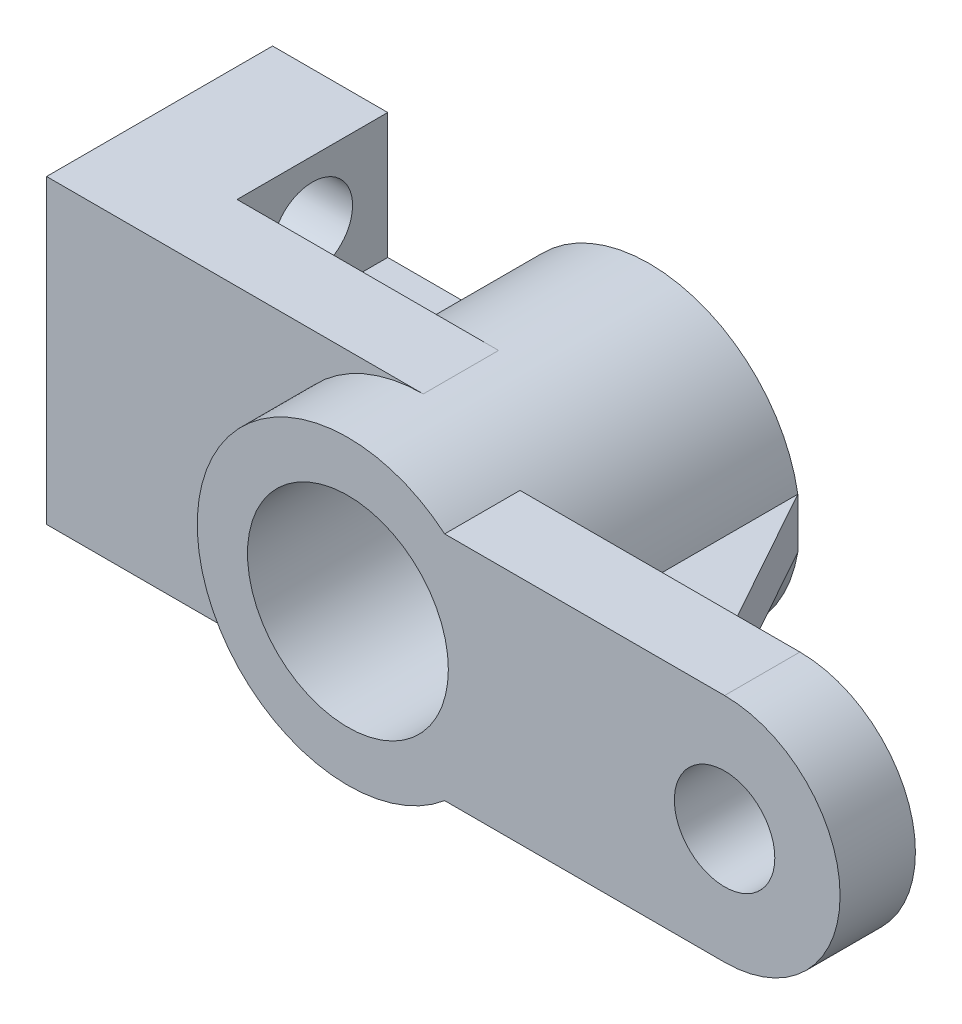
from build123d import *

# Parameters (mm, degrees)
SKETCH1_R           = 30
SKETCH1_R_2         = 20
BOSS_EXTRUDE1_DEPTH = 60
BOSS_EXTRUDE3_START = -15
SKETCH2_R           = 10
BOSS_EXTRUDE3_DEPTH = 15
BOSS_EXTRUDE4_START = -30
BOSS_EXTRUDE4_DEPTH = 15
BOSS_EXTRUDE8_DEPTH = 30
SKETCH9_R           = 8
CUT_EXTRUDE2_DEPTH  = 22.929058222
BOSS_EXTRUDE9_START = 45
BOSS_EXTRUDE9_DEPTH = 45
CUT_EXTRUDE8_DEPTH  = 10


with BuildPart() as part:
    # Sketch1 → Boss-Extrude1 (new body)
    with BuildSketch(Plane.XY):
        Circle(SKETCH1_R)
        Circle(SKETCH1_R_2, mode=Mode.SUBTRACT)
    extrude(amount=BOSS_EXTRUDE1_DEPTH)

    # Sketch2 → Boss-Extrude3 (add)
    with BuildSketch(Plane.XY.offset(60).offset(BOSS_EXTRUDE3_START)):
        with BuildLine():
            Line((75, 23), (19.261360284, 23))
            ThreePointArc((19.261360284, 23), (27.18309041, 12.691713664), (30, 0))
            ThreePointArc((30, 0), (27.18309041, -12.691713664), (19.261360284, -23))
            Line((19.261360284, -23), (75, -23))
            ThreePointArc((75, -23), (98, 0), (75, 23))
        make_face()
        with Locations((75, 0)):
            Circle(SKETCH2_R, mode=Mode.SUBTRACT)
    extrude(amount=BOSS_EXTRUDE3_DEPTH)

    # Sketch3 → Boss-Extrude4 (add)
    with BuildSketch(Plane.XY.offset(60).offset(BOSS_EXTRUDE4_START)):
        with BuildLine():
            Line((0, -30), (-75, -30))
            Line((-75, -30), (-75, 30))
            Line((-75, 30), (0, 30))
            ThreePointArc((0, 30), (-30, 0), (0, -30))
        make_face()
    extrude(amount=BOSS_EXTRUDE4_DEPTH)

    # Sketch5 → Boss-Extrude8 (add)
    with BuildSketch(Plane(origin=(0, 0, 0), x_dir=(-1, 0, 0), z_dir=(0, 0, -1))):
        with BuildLine():
            Line((75, 5), (75, 30))
            Line((75, 30), (52.070941778, 30))
            Line((52.070941778, 30), (52.070941778, 5))
            Line((52.070941778, 5), (29.580398915, 5))
            ThreePointArc((29.580398915, 5), (29.894915684, 2.508787808), (30, 0))
            ThreePointArc((30, 0), (29.894915684, -2.508787808), (29.580398915, -5))
            Line((29.580398915, -5), (52.070941778, -5))
            Line((52.070941778, -5), (52.070941778, -30))
            Line((52.070941778, -30), (75, -30))
            Line((75, -30), (75, -5))
            Line((75, -5), (75, -4.926312307))
            Line((75, -4.926312307), (75, 4.981002017))
            Line((75, 4.981002017), (75, 5))
        make_face()
    extrude(amount=-BOSS_EXTRUDE8_DEPTH)

    # Sketch9 → Cut-Extrude2 (cut)
    with BuildSketch(Plane.ZY.offset(75)):
        with Locations(Location((15, -17.5, 0), (0, 0, 270))):
            Circle(SKETCH9_R)
        with Locations(Location((15, 17.5, 0), (0, 0, 90))):
            Circle(SKETCH9_R)
    extrude(amount=-CUT_EXTRUDE2_DEPTH, mode=Mode.SUBTRACT)

    # Sketch10 → Boss-Extrude9 (add)
    with BuildSketch(Plane(origin=(0, 0, 45), x_dir=(-1, 0, 0), z_dir=(0, 0, -1)).offset(BOSS_EXTRUDE9_START)):
        with BuildLine():
            Line((-29.580398915, 5), (-54.580398915, 5))
            Line((-54.580398915, 5), (-54.580398915, -5))
            Line((-54.580398915, -5), (-29.580398915, -5))
            ThreePointArc((-29.580398915, -5), (-30, 0), (-29.580398915, 5))
        make_face()
    extrude(amount=-BOSS_EXTRUDE9_DEPTH)

    # Sketch11 → Cut-Extrude8 (cut)
    with BuildSketch(Plane(origin=(0, 5, 0), x_dir=(1, 0, 0), z_dir=(0, 1, 0))):
        Polygon((29.580398915, 0), (54.580398915, -45), (54.580398915, 0), align=None)
    extrude(amount=-CUT_EXTRUDE8_DEPTH, mode=Mode.SUBTRACT)


solid = part.part
